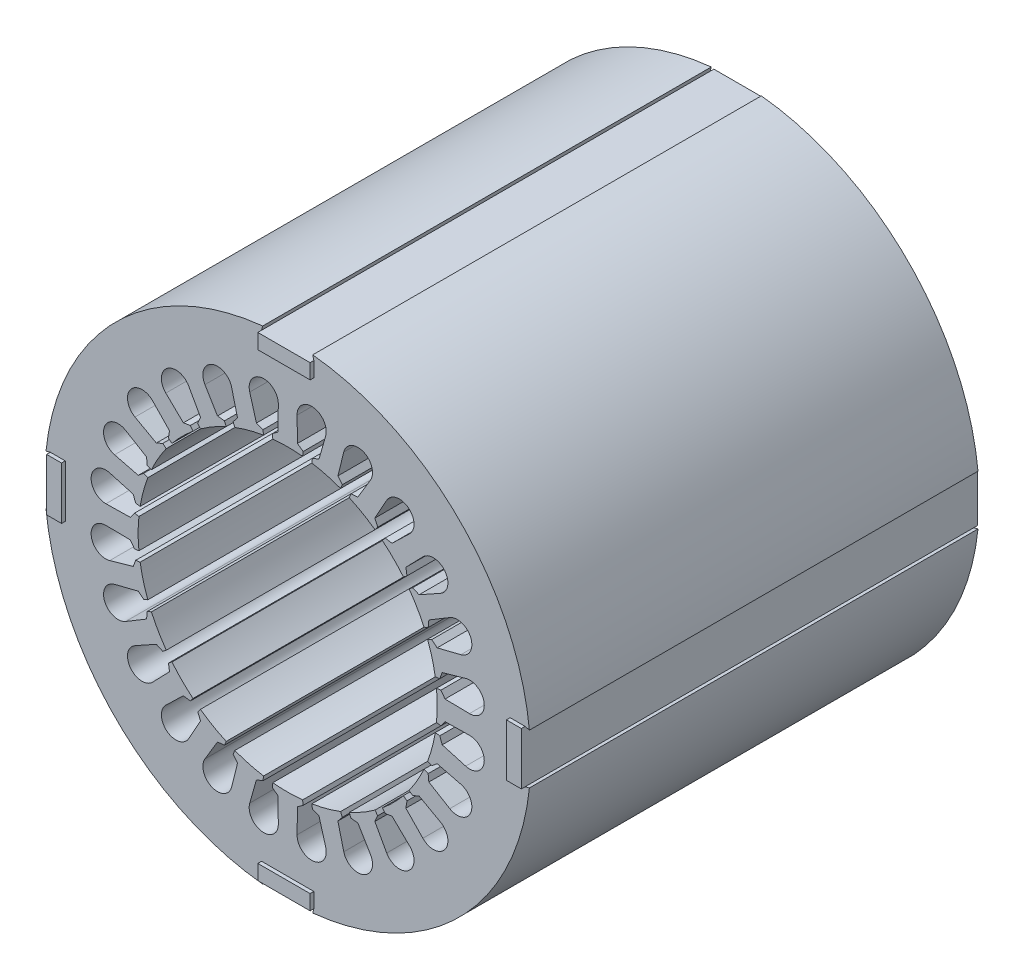
from build123d import *

# Parameters (mm, degrees)
EXTRUDE_1_DEPTH = 120
SKETCH_2_W      = 14
SKETCH_2_H      = 4
SKETCH_2_W_2    = 4
SKETCH_2_H_2    = 14
EXTRUDE_2_DEPTH = 1
SKETCH_3_W      = 14
SKETCH_3_H      = 4
SKETCH_3_W_2    = 4
SKETCH_3_H_2    = 14
EXTRUDE_3_DEPTH = 1
SCALE_1_SCALE   = 0.25


with BuildPart() as part:
    # 草图1 → 拉伸1 (new body)
    with BuildSketch(Plane.XY):
        with BuildLine():
            Line((63.5, 7), (64.654744956, 6.690587022))
            ThreePointArc((64.654744956, 6.690587022), (45.961940777, 45.961940777), (6.690587022, 64.654744956))
            Line((6.690587022, 64.654744956), (7, 63.5))
            Line((7, 63.5), (-7, 63.5))
            Line((-7, 63.5), (-6.690587022, 64.654744956))
            ThreePointArc((-6.690587022, 64.654744956), (-45.961940777, 45.961940777), (-64.654744956, 6.690587022))
            Line((-64.654744956, 6.690587022), (-63.5, 7))
            Line((-63.5, 7), (-63.5, -7))
            Line((-63.5, -7), (-64.654744956, -6.690587022))
            ThreePointArc((-64.654744956, -6.690587022), (-45.961940777, -45.961940777), (-6.690587022, -64.654744956))
            Line((-6.690587022, -64.654744956), (-7, -63.5))
            Line((-7, -63.5), (7, -63.5))
            Line((7, -63.5), (6.690587022, -64.654744956))
            ThreePointArc((6.690587022, -64.654744956), (45.961940777, -45.961940777), (64.654744956, -6.690587022))
            Line((64.654744956, -6.690587022), (63.5, -7))
            Line((63.5, -7), (63.5, 7))
        make_face()
        with BuildLine():
            Line((2.509354046, 48.616380183), (2.615790064, 42.086661107))
            Line((2.615790064, 42.086661107), (4.135897386, 40.991881548))
            Line((4.135897386, 40.991881548), (3.97919165, 39.801583308))
            ThreePointArc((3.97919165, 39.801583308), (0, 40), (-3.97919165, 39.801583308))
            Line((-3.97919165, 39.801583308), (-4.135897386, 40.991881548))
            Line((-4.135897386, 40.991881548), (-2.615790064, 42.086661107))
            Line((-2.615790064, 42.086661107), (-2.509354046, 48.616380183))
            ThreePointArc((-2.509354046, 48.616380183), (-6.917888188, 52.546577653), (-10.158995215, 47.609285817))
            Line((-10.158995215, 47.609285817), (-8.36617026, 41.329609192))
            Line((-8.36617026, 41.329609192), (-6.614509539, 40.665566067))
            Line((-6.614509539, 40.665566067), (-6.457803803, 39.475267827))
            ThreePointArc((-6.457803803, 39.475267827), (-10.352761804, 38.637033052), (-14.145011768, 37.415486661))
            Line((-14.145011768, 37.415486661), (-14.604449739, 38.524668043))
            Line((-14.604449739, 38.524668043), (-13.419488618, 39.975576619))
            Line((-13.419488618, 39.975576619), (-15.006694975, 46.310348582))
            ThreePointArc((-15.006694975, 46.310348582), (-20.282221915, 48.965615223), (-22.135025741, 43.357697301))
            Line((-22.135025741, 43.357697301), (-18.777989907, 37.756012711))
            Line((-18.777989907, 37.756012711), (-16.91414857, 37.567959462))
            Line((-16.91414857, 37.567959462), (-16.454710599, 36.45877808))
            ThreePointArc((-16.454710599, 36.45877808), (-20, 34.641016151), (-23.346872709, 32.479586431))
            Line((-23.346872709, 32.479586431), (-24.077732977, 33.432062076))
            Line((-24.077732977, 33.432062076), (-23.3086712, 35.140222647))
            Line((-23.3086712, 35.140222647), (-26.481354442, 40.848343256))
            ThreePointArc((-26.481354442, 40.848343256), (-32.264355737, 42.047727035), (-32.602590842, 36.151353366))
            Line((-32.602590842, 36.151353366), (-27.910120574, 31.609406359))
            Line((-27.910120574, 31.609406359), (-26.061116328, 31.910158504))
            Line((-26.061116328, 31.910158504), (-25.33025606, 30.957682858))
            ThreePointArc((-25.33025606, 30.957682858), (-28.284271247, 28.284271247), (-30.957682858, 25.33025606))
            Line((-30.957682858, 25.33025606), (-31.910158504, 26.061116328))
            Line((-31.910158504, 26.061116328), (-31.609406359, 27.910120574))
            Line((-31.609406359, 27.910120574), (-36.151353366, 32.602590842))
            ThreePointArc((-36.151353366, 32.602590842), (-42.047727035, 32.264355737), (-40.848343256, 26.481354442))
            Line((-40.848343256, 26.481354442), (-35.140222647, 23.3086712))
            Line((-35.140222647, 23.3086712), (-33.432062076, 24.077732977))
            Line((-33.432062076, 24.077732977), (-32.479586431, 23.346872709))
            ThreePointArc((-32.479586431, 23.346872709), (-34.641016151, 20), (-36.45877808, 16.454710599))
            Line((-36.45877808, 16.454710599), (-37.567959462, 16.91414857))
            Line((-37.567959462, 16.91414857), (-37.756012711, 18.777989907))
            Line((-37.756012711, 18.777989907), (-43.357697301, 22.135025741))
            ThreePointArc((-43.357697301, 22.135025741), (-48.965615223, 20.282221915), (-46.310348582, 15.006694975))
            Line((-46.310348582, 15.006694975), (-39.975576619, 13.419488618))
            Line((-39.975576619, 13.419488618), (-38.524668043, 14.604449739))
            Line((-38.524668043, 14.604449739), (-37.415486661, 14.145011768))
            ThreePointArc((-37.415486661, 14.145011768), (-38.637033052, 10.352761804), (-39.475267827, 6.457803803))
            Line((-39.475267827, 6.457803803), (-40.665566067, 6.614509539))
            Line((-40.665566067, 6.614509539), (-41.329609192, 8.36617026))
            Line((-41.329609192, 8.36617026), (-47.609285817, 10.158995215))
            ThreePointArc((-47.609285817, 10.158995215), (-52.546577653, 6.917888188), (-48.616380183, 2.509354046))
            Line((-48.616380183, 2.509354046), (-42.086661107, 2.615790064))
            Line((-42.086661107, 2.615790064), (-40.991881548, 4.135897386))
            Line((-40.991881548, 4.135897386), (-39.801583308, 3.97919165))
            ThreePointArc((-39.801583308, 3.97919165), (-40, 0), (-39.801583308, -3.97919165))
            Line((-39.801583308, -3.97919165), (-40.991881548, -4.135897386))
            Line((-40.991881548, -4.135897386), (-42.086661107, -2.615790064))
            Line((-42.086661107, -2.615790064), (-48.616380183, -2.509354046))
            ThreePointArc((-48.616380183, -2.509354046), (-52.546577653, -6.917888188), (-47.609285817, -10.158995215))
            Line((-47.609285817, -10.158995215), (-41.329609192, -8.36617026))
            Line((-41.329609192, -8.36617026), (-40.665566067, -6.614509539))
            Line((-40.665566067, -6.614509539), (-39.475267827, -6.457803803))
            ThreePointArc((-39.475267827, -6.457803803), (-38.637033052, -10.352761804), (-37.415486661, -14.145011768))
            Line((-37.415486661, -14.145011768), (-38.524668043, -14.604449739))
            Line((-38.524668043, -14.604449739), (-39.975576619, -13.419488618))
            Line((-39.975576619, -13.419488618), (-46.310348582, -15.006694975))
            ThreePointArc((-46.310348582, -15.006694975), (-48.965615223, -20.282221915), (-43.357697301, -22.135025741))
            Line((-43.357697301, -22.135025741), (-37.756012711, -18.777989907))
            Line((-37.756012711, -18.777989907), (-37.567959462, -16.91414857))
            Line((-37.567959462, -16.91414857), (-36.45877808, -16.454710599))
            ThreePointArc((-36.45877808, -16.454710599), (-34.641016151, -20), (-32.479586431, -23.346872709))
            Line((-32.479586431, -23.346872709), (-33.432062076, -24.077732977))
            Line((-33.432062076, -24.077732977), (-35.140222647, -23.3086712))
            Line((-35.140222647, -23.3086712), (-40.848343256, -26.481354442))
            ThreePointArc((-40.848343256, -26.481354442), (-42.047727035, -32.264355737), (-36.151353366, -32.602590842))
            Line((-36.151353366, -32.602590842), (-31.609406359, -27.910120574))
            Line((-31.609406359, -27.910120574), (-31.910158504, -26.061116328))
            Line((-31.910158504, -26.061116328), (-30.957682858, -25.33025606))
            ThreePointArc((-30.957682858, -25.33025606), (-28.284271247, -28.284271247), (-25.33025606, -30.957682858))
            Line((-25.33025606, -30.957682858), (-26.061116328, -31.910158504))
            Line((-26.061116328, -31.910158504), (-27.910120574, -31.609406359))
            Line((-27.910120574, -31.609406359), (-32.602590842, -36.151353366))
            ThreePointArc((-32.602590842, -36.151353366), (-32.264355737, -42.047727035), (-26.481354442, -40.848343256))
            Line((-26.481354442, -40.848343256), (-23.3086712, -35.140222647))
            Line((-23.3086712, -35.140222647), (-24.077732977, -33.432062076))
            Line((-24.077732977, -33.432062076), (-23.346872709, -32.479586431))
            ThreePointArc((-23.346872709, -32.479586431), (-20, -34.641016151), (-16.454710599, -36.45877808))
            Line((-16.454710599, -36.45877808), (-16.91414857, -37.567959462))
            Line((-16.91414857, -37.567959462), (-18.777989907, -37.756012711))
            Line((-18.777989907, -37.756012711), (-22.135025741, -43.357697301))
            ThreePointArc((-22.135025741, -43.357697301), (-20.282221915, -48.965615223), (-15.006694975, -46.310348582))
            Line((-15.006694975, -46.310348582), (-13.419488618, -39.975576619))
            Line((-13.419488618, -39.975576619), (-14.604449739, -38.524668043))
            Line((-14.604449739, -38.524668043), (-14.145011768, -37.415486661))
            ThreePointArc((-14.145011768, -37.415486661), (-10.352761804, -38.637033052), (-6.457803803, -39.475267827))
            Line((-6.457803803, -39.475267827), (-6.614509539, -40.665566067))
            Line((-6.614509539, -40.665566067), (-8.36617026, -41.329609192))
            Line((-8.36617026, -41.329609192), (-10.158995215, -47.609285817))
            ThreePointArc((-10.158995215, -47.609285817), (-6.917888188, -52.546577653), (-2.509354046, -48.616380183))
            Line((-2.509354046, -48.616380183), (-2.615790064, -42.086661107))
            Line((-2.615790064, -42.086661107), (-4.135897386, -40.991881548))
            Line((-4.135897386, -40.991881548), (-3.97919165, -39.801583308))
            ThreePointArc((-3.97919165, -39.801583308), (0, -40), (3.97919165, -39.801583308))
            Line((3.97919165, -39.801583308), (4.135897386, -40.991881548))
            Line((4.135897386, -40.991881548), (2.615790064, -42.086661107))
            Line((2.615790064, -42.086661107), (2.509354046, -48.616380183))
            ThreePointArc((2.509354046, -48.616380183), (6.917888188, -52.546577653), (10.158995215, -47.609285817))
            Line((10.158995215, -47.609285817), (8.36617026, -41.329609192))
            Line((8.36617026, -41.329609192), (6.614509539, -40.665566067))
            Line((6.614509539, -40.665566067), (6.457803803, -39.475267827))
            ThreePointArc((6.457803803, -39.475267827), (10.352761804, -38.637033052), (14.145011768, -37.415486661))
            Line((14.145011768, -37.415486661), (14.604449739, -38.524668043))
            Line((14.604449739, -38.524668043), (13.419488618, -39.975576619))
            Line((13.419488618, -39.975576619), (15.006694975, -46.310348582))
            ThreePointArc((15.006694975, -46.310348582), (20.282221915, -48.965615223), (22.135025741, -43.357697301))
            Line((22.135025741, -43.357697301), (18.777989907, -37.756012711))
            Line((18.777989907, -37.756012711), (16.91414857, -37.567959462))
            Line((16.91414857, -37.567959462), (16.454710599, -36.45877808))
            ThreePointArc((16.454710599, -36.45877808), (20, -34.641016151), (23.346872709, -32.479586431))
            Line((23.346872709, -32.479586431), (24.077732977, -33.432062076))
            Line((24.077732977, -33.432062076), (23.3086712, -35.140222647))
            Line((23.3086712, -35.140222647), (26.481354442, -40.848343256))
            ThreePointArc((26.481354442, -40.848343256), (32.264355737, -42.047727035), (32.602590842, -36.151353366))
            Line((32.602590842, -36.151353366), (27.910120574, -31.609406359))
            Line((27.910120574, -31.609406359), (26.061116328, -31.910158504))
            Line((26.061116328, -31.910158504), (25.33025606, -30.957682858))
            ThreePointArc((25.33025606, -30.957682858), (28.284271247, -28.284271247), (30.957682858, -25.33025606))
            Line((30.957682858, -25.33025606), (31.910158504, -26.061116328))
            Line((31.910158504, -26.061116328), (31.609406359, -27.910120574))
            Line((31.609406359, -27.910120574), (36.151353366, -32.602590842))
            ThreePointArc((36.151353366, -32.602590842), (42.047727035, -32.264355737), (40.848343256, -26.481354442))
            Line((40.848343256, -26.481354442), (35.140222647, -23.3086712))
            Line((35.140222647, -23.3086712), (33.432062076, -24.077732977))
            Line((33.432062076, -24.077732977), (32.479586431, -23.346872709))
            ThreePointArc((32.479586431, -23.346872709), (34.641016151, -20), (36.45877808, -16.454710599))
            Line((36.45877808, -16.454710599), (37.567959462, -16.91414857))
            Line((37.567959462, -16.91414857), (37.756012711, -18.777989907))
            Line((37.756012711, -18.777989907), (43.357697301, -22.135025741))
            ThreePointArc((43.357697301, -22.135025741), (48.965615223, -20.282221915), (46.310348582, -15.006694975))
            Line((46.310348582, -15.006694975), (39.975576619, -13.419488618))
            Line((39.975576619, -13.419488618), (38.524668043, -14.604449739))
            Line((38.524668043, -14.604449739), (37.415486661, -14.145011768))
            ThreePointArc((37.415486661, -14.145011768), (38.637033052, -10.352761804), (39.475267827, -6.457803803))
            Line((39.475267827, -6.457803803), (40.665566067, -6.614509539))
            Line((40.665566067, -6.614509539), (41.329609192, -8.36617026))
            Line((41.329609192, -8.36617026), (47.609285817, -10.158995215))
            ThreePointArc((47.609285817, -10.158995215), (52.546577653, -6.917888188), (48.616380183, -2.509354046))
            Line((48.616380183, -2.509354046), (42.086661107, -2.615790064))
            Line((42.086661107, -2.615790064), (40.991881548, -4.135897386))
            Line((40.991881548, -4.135897386), (39.801583308, -3.97919165))
            ThreePointArc((39.801583308, -3.97919165), (40, 0), (39.801583308, 3.97919165))
            Line((39.801583308, 3.97919165), (40.991881548, 4.135897386))
            Line((40.991881548, 4.135897386), (42.086661107, 2.615790064))
            Line((42.086661107, 2.615790064), (48.616380183, 2.509354046))
            ThreePointArc((48.616380183, 2.509354046), (52.546577653, 6.917888188), (47.609285817, 10.158995215))
            Line((47.609285817, 10.158995215), (41.329609192, 8.36617026))
            Line((41.329609192, 8.36617026), (40.665566067, 6.614509539))
            Line((40.665566067, 6.614509539), (39.475267827, 6.457803803))
            ThreePointArc((39.475267827, 6.457803803), (38.637033052, 10.352761804), (37.415486661, 14.145011768))
            Line((37.415486661, 14.145011768), (38.524668043, 14.604449739))
            Line((38.524668043, 14.604449739), (39.975576619, 13.419488618))
            Line((39.975576619, 13.419488618), (46.310348582, 15.006694975))
            ThreePointArc((46.310348582, 15.006694975), (48.965615223, 20.282221915), (43.357697301, 22.135025741))
            Line((43.357697301, 22.135025741), (37.756012711, 18.777989907))
            Line((37.756012711, 18.777989907), (37.567959462, 16.91414857))
            Line((37.567959462, 16.91414857), (36.45877808, 16.454710599))
            ThreePointArc((36.45877808, 16.454710599), (34.641016151, 20), (32.479586431, 23.346872709))
            Line((32.479586431, 23.346872709), (33.432062076, 24.077732977))
            Line((33.432062076, 24.077732977), (35.140222647, 23.3086712))
            Line((35.140222647, 23.3086712), (40.848343256, 26.481354442))
            ThreePointArc((40.848343256, 26.481354442), (42.047727035, 32.264355737), (36.151353366, 32.602590842))
            Line((36.151353366, 32.602590842), (31.609406359, 27.910120574))
            Line((31.609406359, 27.910120574), (31.910158504, 26.061116328))
            Line((31.910158504, 26.061116328), (30.957682858, 25.33025606))
            ThreePointArc((30.957682858, 25.33025606), (28.284271247, 28.284271247), (25.33025606, 30.957682858))
            Line((25.33025606, 30.957682858), (26.061116328, 31.910158504))
            Line((26.061116328, 31.910158504), (27.910120574, 31.609406359))
            Line((27.910120574, 31.609406359), (32.602590842, 36.151353366))
            ThreePointArc((32.602590842, 36.151353366), (32.264355737, 42.047727035), (26.481354442, 40.848343256))
            Line((26.481354442, 40.848343256), (23.3086712, 35.140222647))
            Line((23.3086712, 35.140222647), (24.077732977, 33.432062076))
            Line((24.077732977, 33.432062076), (23.346872709, 32.479586431))
            ThreePointArc((23.346872709, 32.479586431), (20, 34.641016151), (16.454710599, 36.45877808))
            Line((16.454710599, 36.45877808), (16.91414857, 37.567959462))
            Line((16.91414857, 37.567959462), (18.777989907, 37.756012711))
            Line((18.777989907, 37.756012711), (22.135025741, 43.357697301))
            ThreePointArc((22.135025741, 43.357697301), (20.282221915, 48.965615223), (15.006694975, 46.310348582))
            Line((15.006694975, 46.310348582), (13.419488618, 39.975576619))
            Line((13.419488618, 39.975576619), (14.604449739, 38.524668043))
            Line((14.604449739, 38.524668043), (14.145011768, 37.415486661))
            ThreePointArc((14.145011768, 37.415486661), (10.352761804, 38.637033052), (6.457803803, 39.475267827))
            Line((6.457803803, 39.475267827), (6.614509539, 40.665566067))
            Line((6.614509539, 40.665566067), (8.36617026, 41.329609192))
            Line((8.36617026, 41.329609192), (10.158995215, 47.609285817))
            ThreePointArc((10.158995215, 47.609285817), (6.917888188, 52.546577653), (2.509354046, 48.616380183))
        make_face(mode=Mode.SUBTRACT)
    extrude(amount=EXTRUDE_1_DEPTH)

    # 草图2 → 拉伸2 (add)
    with BuildSketch(Plane.XY.offset(120)):
        with Locations((0, 61.5)):
            Rectangle(SKETCH_2_W, SKETCH_2_H)
        with Locations((61.5, 0)):
            Rectangle(SKETCH_2_W_2, SKETCH_2_H_2)
        with Locations((0, -61.5)):
            Rectangle(SKETCH_2_W, SKETCH_2_H)
        with Locations((-61.5, 0)):
            Rectangle(SKETCH_2_W_2, SKETCH_2_H_2)
    extrude(amount=EXTRUDE_2_DEPTH)

    # 草图3 → 拉伸3 (add)
    with BuildSketch(Plane(origin=(0, 0, 0), x_dir=(-1, 0, 0), z_dir=(0, 0, -1))):
        with Locations((0, 61.5)):
            Rectangle(SKETCH_3_W, SKETCH_3_H)
        with Locations((61.5, 0)):
            Rectangle(SKETCH_3_W_2, SKETCH_3_H_2)
        with Locations((0, -61.5)):
            Rectangle(SKETCH_3_W, SKETCH_3_H)
        with Locations((-61.5, 0)):
            Rectangle(SKETCH_3_W_2, SKETCH_3_H_2)
    extrude(amount=EXTRUDE_3_DEPTH)


with BuildPart() as part_1:
    # 缩放比例1: scaled about (0, 0, 0)
    add(part.part.scale(SCALE_1_SCALE))


solid = part_1.part
